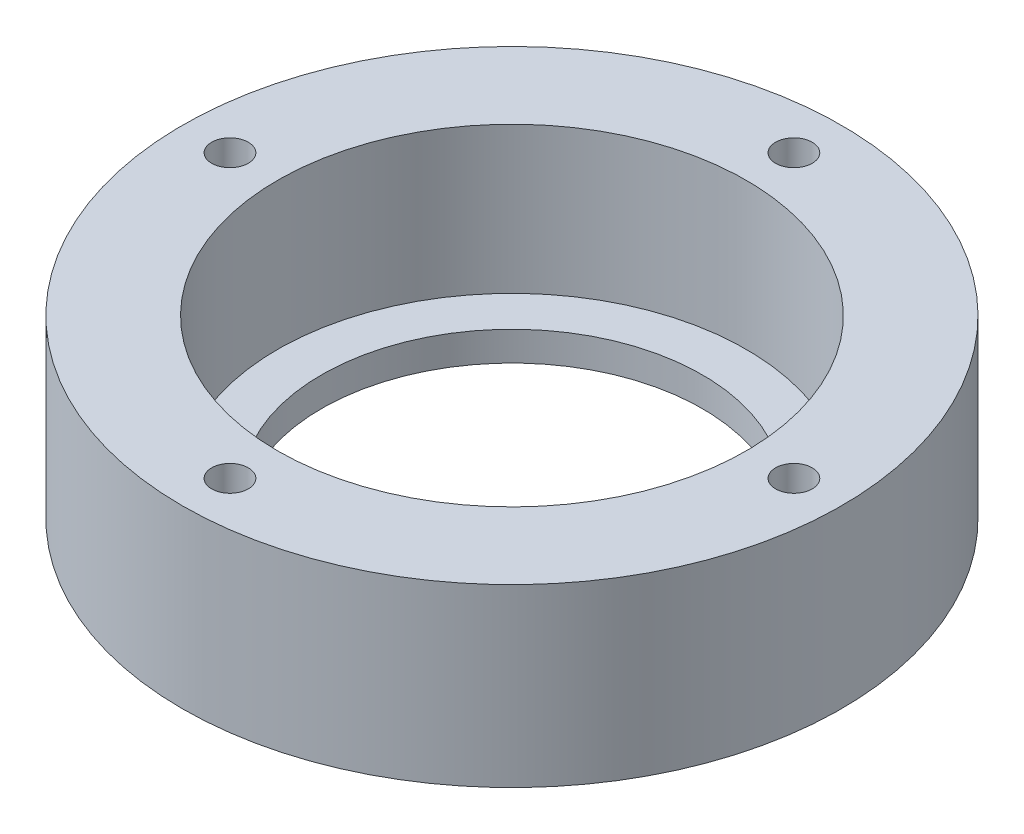
from build123d import *

# Parameters (mm, degrees)
SKETCH_1_R          = 22.5
EXTRUDE_1_DEPTH     = 12
SKETCH_2_R          = 16
CUT_EXTRUDE_1_DEPTH = 10
SKETCH_3_R          = 13
CUT_EXTRUDE_2_DEPTH = 34.35416016
M3X0_51_D           = 2.5
M3X0_51_DEPTH       = 8.5
M3X0_51_TIP         = 0.751075774


with BuildPart() as part:
    # Эскиз1 → Бобышка-Вытянуть1 (new body)
    with BuildSketch(Plane(origin=(0, 0, 0), x_dir=(1, 0, 0), z_dir=(0, 1, 0))):
        with Locations(Location((0, 0, 0), (0, 0, 270))):
            Circle(SKETCH_1_R)
    extrude(amount=EXTRUDE_1_DEPTH)

    # Эскиз2 → Вырез-Вытянуть1 (cut)
    with BuildSketch(Plane(origin=(0, 12, 0), x_dir=(1, 0, 0), z_dir=(0, 1, 0))):
        with Locations(Location((0, 0, 0), (0, 0, 270))):
            Circle(SKETCH_2_R)
    extrude(amount=-CUT_EXTRUDE_1_DEPTH, mode=Mode.SUBTRACT)

    # Эскиз3 → Вырез-Вытянуть2 (cut, through all)
    with BuildSketch(Plane(origin=(0, 2, 0), x_dir=(1, 0, 0), z_dir=(0, 1, 0))):
        with Locations(Location((0, 0, 0), (0, 0, 270))):
            Circle(SKETCH_3_R)
    extrude(amount=-CUT_EXTRUDE_2_DEPTH, mode=Mode.SUBTRACT)

    # Отверстие обработанное метчиком M3x0.51
    with Locations(Plane(origin=(0, 12, 0), x_dir=(1, 0, 0), z_dir=(0, 1, 0))):
        with Locations((-19.25, 0), (0, -19.25), (19.25, 0), (0, 19.25)):
            Hole(M3X0_51_D / 2, depth=M3X0_51_DEPTH)
            with Locations((0, 0, -(M3X0_51_DEPTH + M3X0_51_TIP / 2))):  # 118° drill point
                Cone(0, M3X0_51_D / 2, M3X0_51_TIP, mode=Mode.SUBTRACT)


solid = part.part
